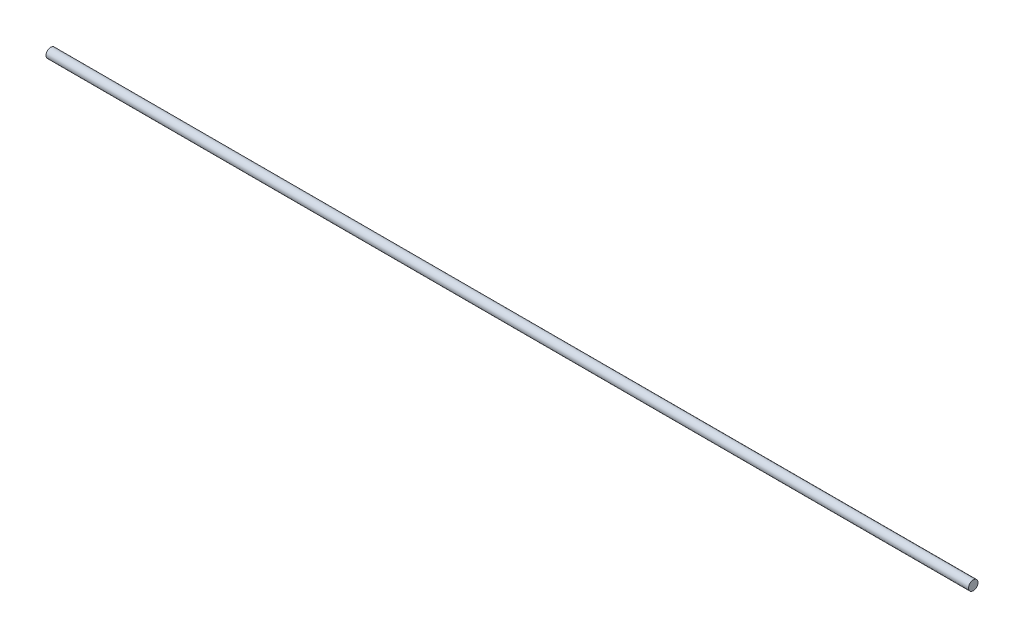
from build123d import *

# Parameters (mm, degrees)
SKETCH1_R           = 6.35
BOSS_EXTRUDE1_DEPTH = 618.33125


with BuildPart() as part:
    # Sketch1 → Boss-Extrude1 (new, symmetric)
    with BuildSketch(Plane(origin=(0, 0, 0), x_dir=(0, 0, -1), z_dir=(1, 0, 0))):
        Circle(SKETCH1_R)
    extrude(amount=BOSS_EXTRUDE1_DEPTH, both=True)


solid = part.part
